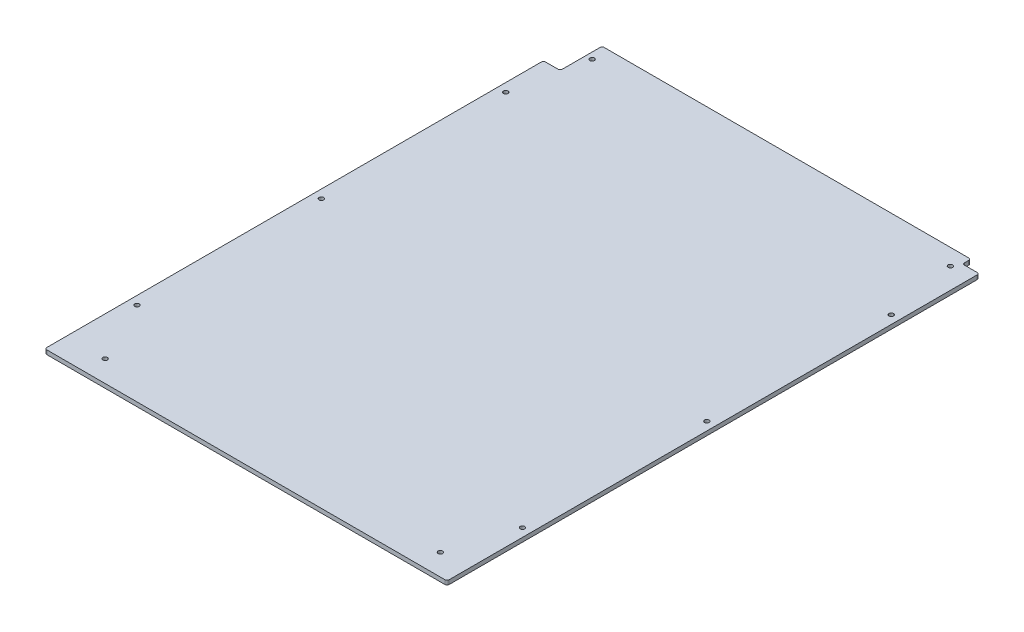
from build123d import *

# Parameters (mm, degrees)
SKETCH1_R           = 3.429
BOSS_EXTRUDE1_DEPTH = 6.35
FILLET1_R           = 3.175


with BuildPart() as part:
    # Sketch1 → Boss-Extrude1 (new body)
    with BuildSketch(Plane(origin=(0, 0, 0), x_dir=(1, 0, 0), z_dir=(0, 1, 0))):
        Polygon((0, 0), (0, 755.65), (25.4, 755.65), (25.4, 819.15), (584.2, 819.15), (584.2, 806.45), (609.6, 806.45), (609.6, 0), align=None)
        with Locations(Location((12.7, 685.8, 0), (0, 0, 270))):
            Circle(SKETCH1_R, mode=Mode.SUBTRACT)
        with Locations(Location((12.7, 127, 0), (0, 0, 270))):
            Circle(SKETCH1_R, mode=Mode.SUBTRACT)
        with Locations(Location((577.85, 794.512, 0), (0, 0, 270))):
            Circle(SKETCH1_R, mode=Mode.SUBTRACT)
        with Locations(Location((566.928, 32.512, 0), (0, 0, 270))):
            Circle(SKETCH1_R, mode=Mode.SUBTRACT)
        with Locations(Location((596.9, 685.8, 0), (0, 0, 270))):
            Circle(SKETCH1_R, mode=Mode.SUBTRACT)
        with Locations(Location((596.9, 406.4, 0), (0, 0, 270))):
            Circle(SKETCH1_R, mode=Mode.SUBTRACT)
        with Locations(Location((34.925, 794.512, 0), (0, 0, 270))):
            Circle(SKETCH1_R, mode=Mode.SUBTRACT)
        with Locations(Location((58.928, 32.512, 0), (0, 0, 270))):
            Circle(SKETCH1_R, mode=Mode.SUBTRACT)
        with Locations(Location((596.9, 127, 0), (0, 0, 270))):
            Circle(SKETCH1_R, mode=Mode.SUBTRACT)
        with Locations(Location((12.7, 406.4, 0), (0, 0, 270))):
            Circle(SKETCH1_R, mode=Mode.SUBTRACT)
    extrude(amount=BOSS_EXTRUDE1_DEPTH)

    # Fillet1
    fillet1_edges = [part.edges().sort_by_distance(p)[0] for p in [
        (0, 3.175, 0),
        (0, 3.175, -755.65),
        (25.4, 3.175, -755.65),
        (25.4, 3.175, -819.15),
        (584.2, 3.175, -819.15),
        (584.2, 3.175, -806.45),
        (609.6, 3.175, -806.45),
        (609.6, 3.175, 0),
    ]]
    fillet(fillet1_edges, radius=FILLET1_R)


solid = part.part
